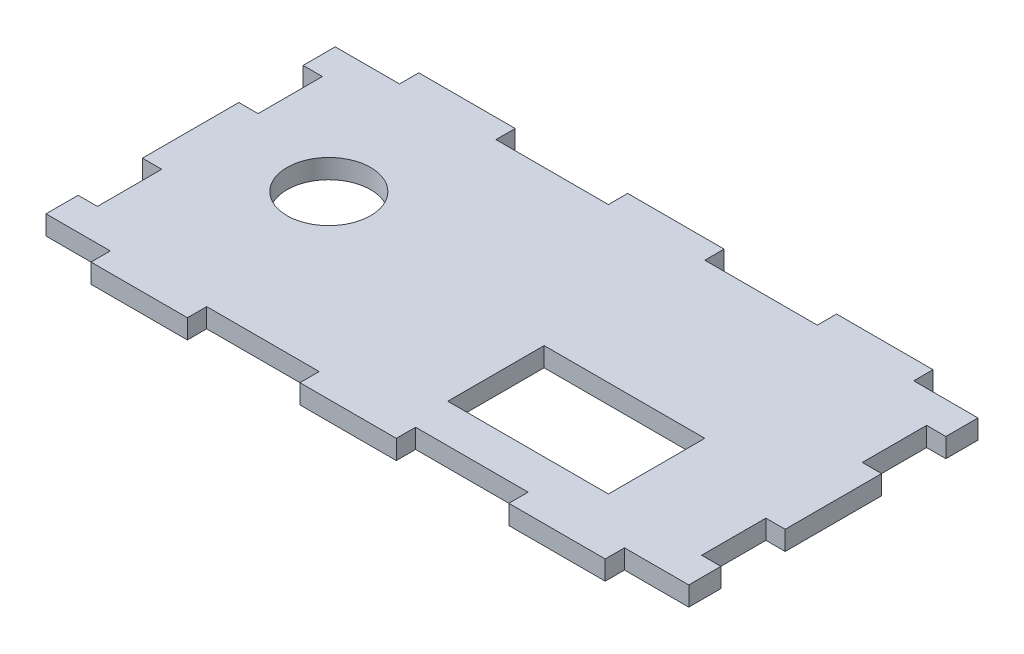
from build123d import *

# Parameters (mm, degrees)
EXTRUDE_1_DEPTH     = 3
SKETCH_2_R          = 6.5
SKETCH_2_W          = 25
SKETCH_2_H          = 15
CUT_EXTRUDE_1_DEPTH = 57.207205944


with BuildPart() as part:
    # 草图1 → 凸台-拉伸1 (new body)
    with BuildSketch(Plane(origin=(0, 0, 0), x_dir=(1, 0, 0), z_dir=(0, 1, 0))):
        Polygon((-50, -22.5), (-40, -22.5), (-40, -25.5), (-25, -25.5), (-25, -22.5), (-7.5, -22.5), (-7.5, -25.5), (7.5, -25.5), (7.5, -22.5), (25, -22.5), (25, -25.5), (40, -25.5), (40, -22.5), (50, -22.5), (50, -17.5), (47, -17.5), (47, -7.5), (50, -7.5), (50, 7.5), (47, 7.5), (47, 17.5), (50, 17.5), (50, 22.5), (40, 22.5), (40, 25.5), (25, 25.5), (25, 22.5), (7.5, 22.5), (7.5, 25.5), (-7.5, 25.5), (-7.5, 22.5), (-25, 22.5), (-25, 25.5), (-40, 25.5), (-40, 22.5), (-50, 22.5), (-50, 17.5), (-47, 17.5), (-47, 7.5), (-50, 7.5), (-50, -7.5), (-47, -7.5), (-47, -17.5), (-50, -17.5), align=None)
    extrude(amount=EXTRUDE_1_DEPTH)

    # 草图2 → 切除-拉伸1 (cut, through all)
    with BuildSketch(Plane(origin=(0, 3, 0), x_dir=(1, 0, 0), z_dir=(0, 1, 0))):
        with Locations(Location((-31, 2.5, 0), (0, 0, 270))):
            Circle(SKETCH_2_R)
        with Locations((19, -9)):
            Rectangle(SKETCH_2_W, SKETCH_2_H)
    extrude(amount=-CUT_EXTRUDE_1_DEPTH, mode=Mode.SUBTRACT)


solid = part.part
